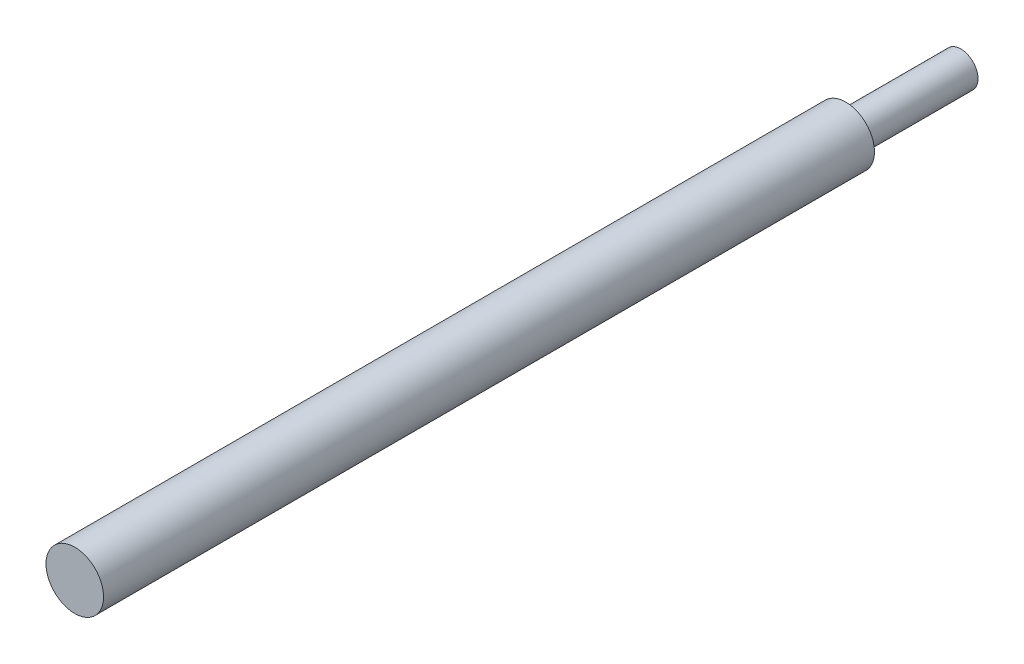
from build123d import *

# Parameters (mm, degrees)
ESQUISSE1_R             = 2.5
BOSS_EXTRU_1_DEPTH      = 77
ESQUISSE3_R             = 2.5
ESQUISSE3_R_2           = 1.5
ENL_V_MAT_EXTRU_2_DEPTH = 10


with BuildPart() as part:
    # Esquisse1 → Boss.-Extru.1 (new body)
    with BuildSketch(Plane.XY):
        Circle(ESQUISSE1_R)
    extrude(amount=BOSS_EXTRU_1_DEPTH)

    # Esquisse3 → Enlèv. mat.-Extru.2 (cut)
    with BuildSketch(Plane(origin=(0, 0, 0), x_dir=(-1, 0, 0), z_dir=(0, 0, -1))):
        Circle(ESQUISSE3_R)
        Circle(ESQUISSE3_R_2, mode=Mode.SUBTRACT)
    extrude(amount=-ENL_V_MAT_EXTRU_2_DEPTH, mode=Mode.SUBTRACT)


solid = part.part
